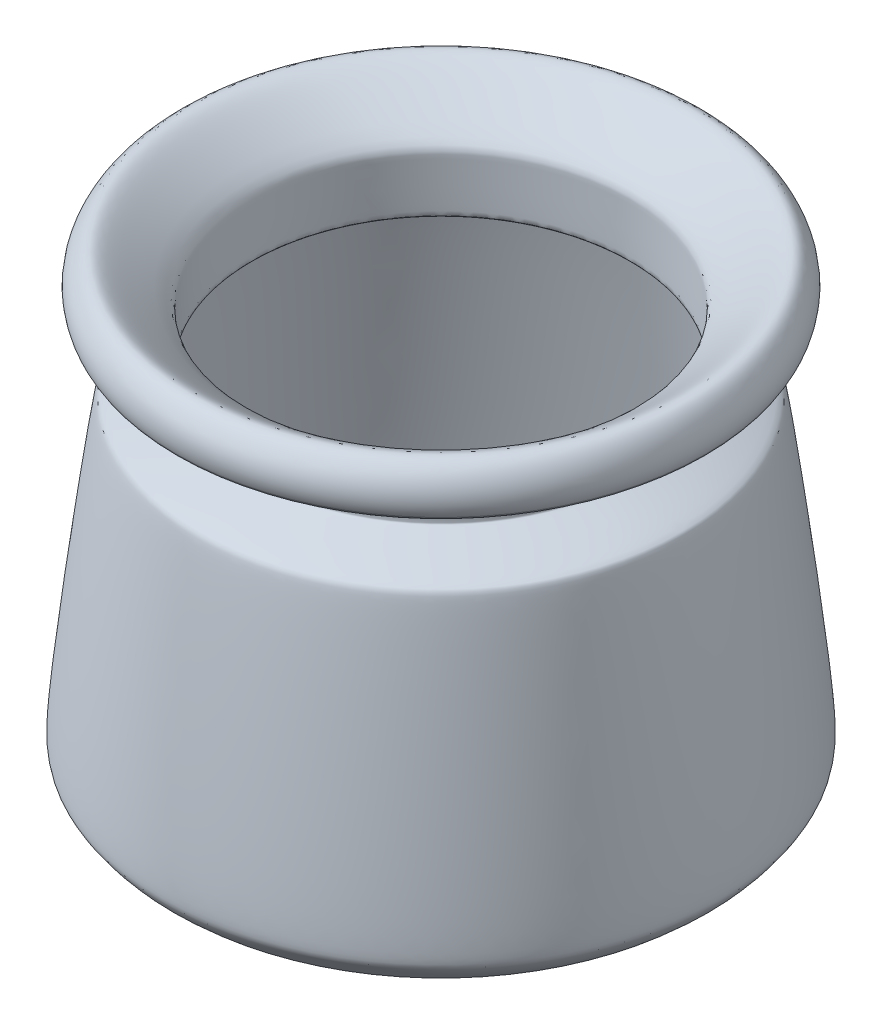
from build123d import *

# Parameters (mm, degrees)
SHELL1_T  = -1.999996
FILLET1_R = 0.762


with BuildPart() as part:
    # Sketch1 → Revolve1 (revolve)
    with BuildSketch(Plane.XY, mode=Mode.PRIVATE) as revolve1_sk:
        with BuildLine():
            Line((246.38, 137.301011272), (296.397313201, 137.301011272))
            Line((296.397313201, 137.301011272), (296.397313201, 217.604569273))
            Line((296.397313201, 217.604569273), (0, 217.604569273))
            Line((0, 217.604569273), (0, -254.146538462))
            add(Edge.make_bspline(
                [(0, -254.146538462), (109.308058412, -254.062180276), (126.762706974, -254.188849644), (149.968168963, -254.167501271), (231.441882243, -247.633224858), (247.811560945, -240.842200026), (259.869025801, -226.092133317), (267.178048812, -210.911635216), (233.02015933, 59.004008297), (226.762558507, 67.337138563), (180.382295171, 83.541510556), (179.22992782, 84.460095843), (179.782561893, 128.471590049), (179.764253938, 137.934324687), (187.747666438, 145.801366207), (225.119183547, 175.239024272), (232.541822406, 178.563500311), (245.24169619, 175.77074427), (256.933544307, 152.470678541), (246.38, 137.301011272)],
                knots=[0, 0, 0, 0, 0.077984184, 0.09479904, 0.15999861, 0.179903, 0.273938555, 0.302112694, 0.433470251, 0.462409674, 0.5625675, 0.584872302, 0.663152896, 0.680356396, 0.739703807, 0.755891492, 0.826045564, 0.851333341, 1, 1, 1, 1], degree=3))
        make_face()
    revolve(revolve1_sk.sketch.rotate(Axis((0, 217.604569273, 0), (0, -1, 0)), 90), axis=Axis((0, 217.604569273, 0), (0, -1, 0)))

    # Shell1
    shell1_openings = [part.faces().sort_by_distance(p)[0] for p in [
        (0, 217.604569273, 0),
    ]]
    offset(amount=SHELL1_T, openings=shell1_openings)

    # Sketch2 → Cut-Revolve1 (revolve, cut)
    with BuildSketch(Plane.XY, mode=Mode.PRIVATE) as cut_revolve1_sk:
        Polygon((-249.912234219, 139.301007272), (-248.677932843, 137.301011272), (-248.543911754, 136.658707836), (-302.071047179, 132.990009198), (-302.071047179, 230.099368822), (-257.698409849, 220.337079731), (-256.191274285, 145.109657989), align=None)
    revolve(cut_revolve1_sk.sketch.rotate(Axis((0, 0, 0), (0, 1, 0)), 270), axis=Axis((0, 0, 0), (0, 1, 0)), mode=Mode.SUBTRACT)

    # Fillet1
    fillet1_edges = [part.edges().sort_by_distance(p)[0] for p in [
        (0, 137.301011272, 248.677932843),
        (0, 137.301011272, -246.38),
    ]]
    fillet(fillet1_edges, radius=FILLET1_R)


solid = part.part
